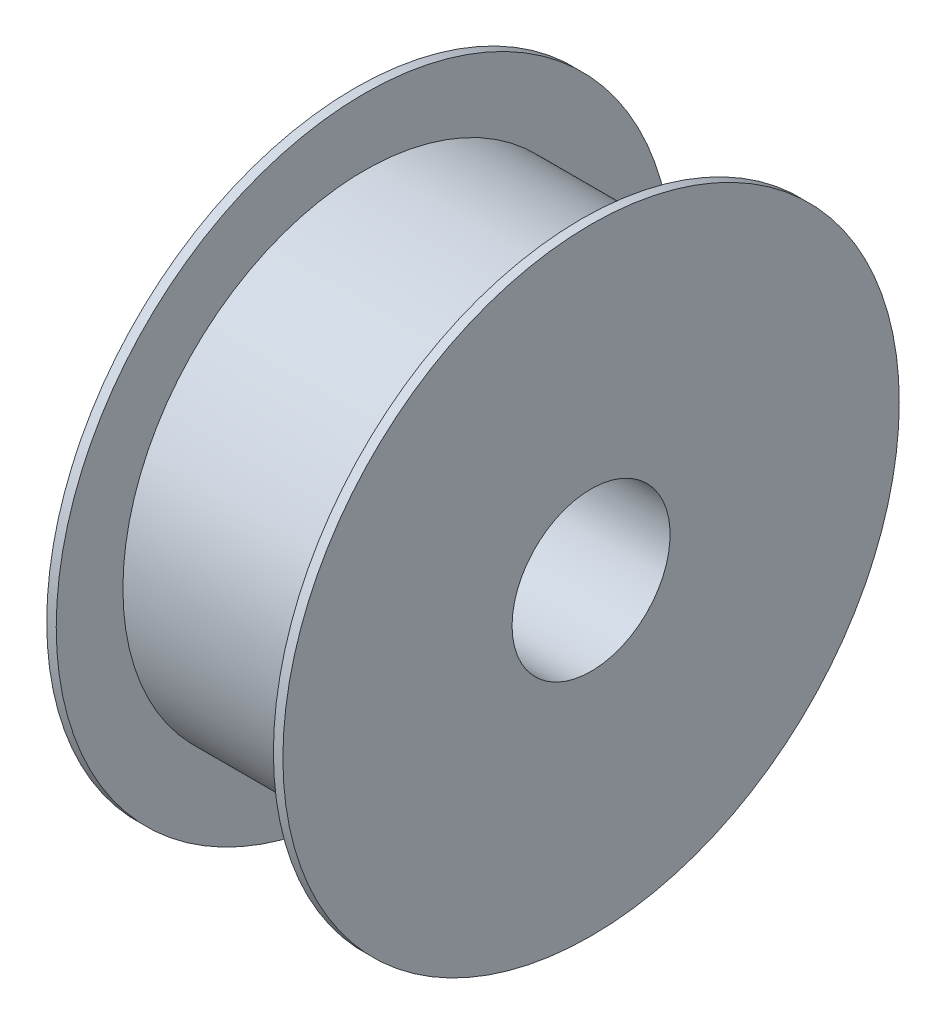
from build123d import *


with BuildPart() as part:
    # Sketch1 → Revolve1 (revolve)
    with BuildSketch(Plane(origin=(0, 0, 0), x_dir=(1, 0, 0), z_dir=(0, 1, 0)), mode=Mode.PRIVATE) as revolve1_sk:
        Polygon((0, 58.783038795), (0, 131.283038795), (3, 131.283038795), (3, 110.189064257), (71.707548459, 110.189064257), (71.707548459, 131.283038795), (74.707548459, 131.283038795), (74.707548459, 58.783038795), align=None)
    revolve(revolve1_sk.sketch.rotate(Axis((-2.327356302, 0, -33.783038795), (1, 0, 0)), 180), axis=Axis((-2.327356302, 0, -33.783038795), (1, 0, 0)))


solid = part.part
